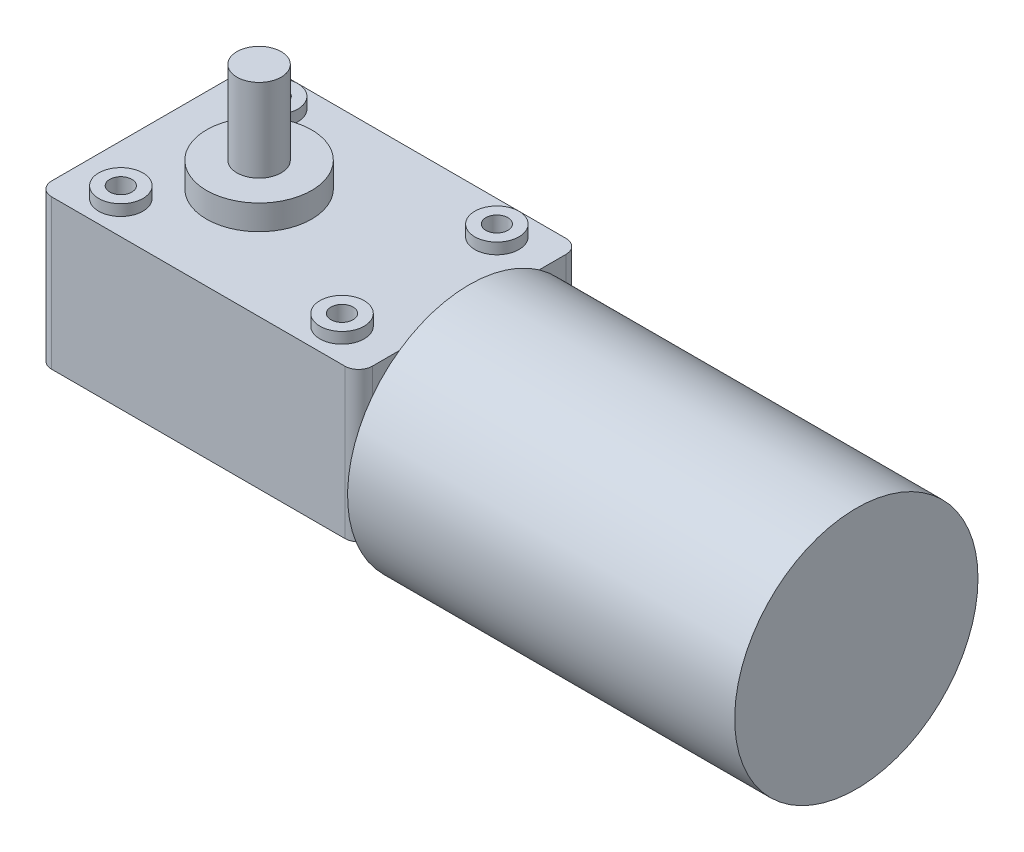
from build123d import *

# Parameters (mm, degrees)
BOSS_EXTRUDE1_DEPTH = 13.5
SKETCH2_R           = 4
BOSS_EXTRUDE2_DEPTH = 2
SKETCH3_R           = 2
CUT_EXTRUDE1_DEPTH  = 6
SKETCH6_R           = 9.5
BOSS_EXTRUDE5_DEPTH = 4.5
SKETCH4_R           = 4
BOSS_EXTRUDE3_DEPTH = 15
SKETCH5_R           = 22
BOSS_EXTRUDE4_DEPTH = 70
SKETCH7_R           = 4
CUT_EXTRUDE2_DEPTH  = 1.7


with BuildPart() as part:
    # Sketch1 → Boss-Extrude1 (new, symmetric)
    with BuildSketch(Plane(origin=(0, 0, 0), x_dir=(1, 0, 0), z_dir=(0, 1, 0))):
        with BuildLine():
            Line((-26.5, -20), (26.5, -20))
            ThreePointArc((26.5, -20), (28.267766953, -19.267766953), (29, -17.5))
            Line((29, -17.5), (29, 17.5))
            ThreePointArc((29, 17.5), (28.267766953, 19.267766953), (26.5, 20))
            Line((26.5, 20), (-26.5, 20))
            ThreePointArc((-26.5, 20), (-28.267766953, 19.267766953), (-29, 17.5))
            Line((-29, 17.5), (-29, -17.5))
            ThreePointArc((-29, -17.5), (-28.267766953, -19.267766953), (-26.5, -20))
        make_face()
    extrude(amount=BOSS_EXTRUDE1_DEPTH, both=True)

    # Sketch2 → Boss-Extrude2 (add)
    with BuildSketch(Plane(origin=(0, 13.5, 0), x_dir=(1, 0, 0), z_dir=(0, 1, 0))):
        with Locations(Location((-20, 14, 0), (0, 0, 270))):
            Circle(SKETCH2_R)
        with Locations(Location((-20, -14, 0), (0, 0, 270))):
            Circle(SKETCH2_R)
        with Locations(Location((20, -14, 0), (0, 0, 270))):
            Circle(SKETCH2_R)
        with Locations(Location((20, 14, 0), (0, 0, 270))):
            Circle(SKETCH2_R)
    boss_extrude2 = extrude(amount=BOSS_EXTRUDE2_DEPTH)

    # Sketch3 → Cut-Extrude1 (cut)
    with BuildSketch(Plane(origin=(0, 15.5, 0), x_dir=(1, 0, 0), z_dir=(0, 1, 0))):
        with Locations(Location((-20, 14, 0), (0, 0, 270))):
            Circle(SKETCH3_R)
        with Locations(Location((20, 14, 0), (0, 0, 270))):
            Circle(SKETCH3_R)
        with Locations(Location((20, -14, 0), (0, 0, 270))):
            Circle(SKETCH3_R)
        with Locations(Location((-20, -14, 0), (0, 0, 270))):
            Circle(SKETCH3_R)
    cut_extrude1 = extrude(amount=-CUT_EXTRUDE1_DEPTH, mode=Mode.SUBTRACT)

    # Sketch6 → Boss-Extrude5 (add)
    with BuildSketch(Plane(origin=(0, 13.5, 0), x_dir=(1, 0, 0), z_dir=(0, 1, 0))):
        with Locations(Location((-9, 0, 0), (0, 0, 270))):
            Circle(SKETCH6_R)
    boss_extrude5 = extrude(amount=BOSS_EXTRUDE5_DEPTH)

    # Sketch4 → Boss-Extrude3 (add)
    with BuildSketch(Plane(origin=(0, 18, 0), x_dir=(1, 0, 0), z_dir=(0, 1, 0))):
        with Locations(Location((-9, 0, 0), (0, 0, 270))):
            Circle(SKETCH4_R)
    extrude(amount=BOSS_EXTRUDE3_DEPTH)

    # Sketch5 → Boss-Extrude4 (add)
    with BuildSketch(Plane(origin=(29, 0, 0), x_dir=(0, 0, -1), z_dir=(1, 0, 0))):
        with Locations(Location((0, -4.5, 0), (0, 0, 142.698209708))):
            Circle(SKETCH5_R)
    extrude(amount=BOSS_EXTRUDE4_DEPTH)

    # Mirror2: Boss-Extrude2, Cut-Extrude1, Boss-Extrude5 across plane
    add(boss_extrude2.mirror(Plane.ZX))
    add(cut_extrude1.mirror(Plane.ZX), mode=Mode.SUBTRACT)
    add(boss_extrude5.mirror(Plane.ZX))

    # Sketch7 → Cut-Extrude2 (cut)
    with BuildSketch(Plane.XZ.offset(18)):
        with Locations(Location((-9, 0, 0), (0, 0, 90))):
            Circle(SKETCH7_R)
    extrude(amount=-CUT_EXTRUDE2_DEPTH, mode=Mode.SUBTRACT)


solid = part.part
